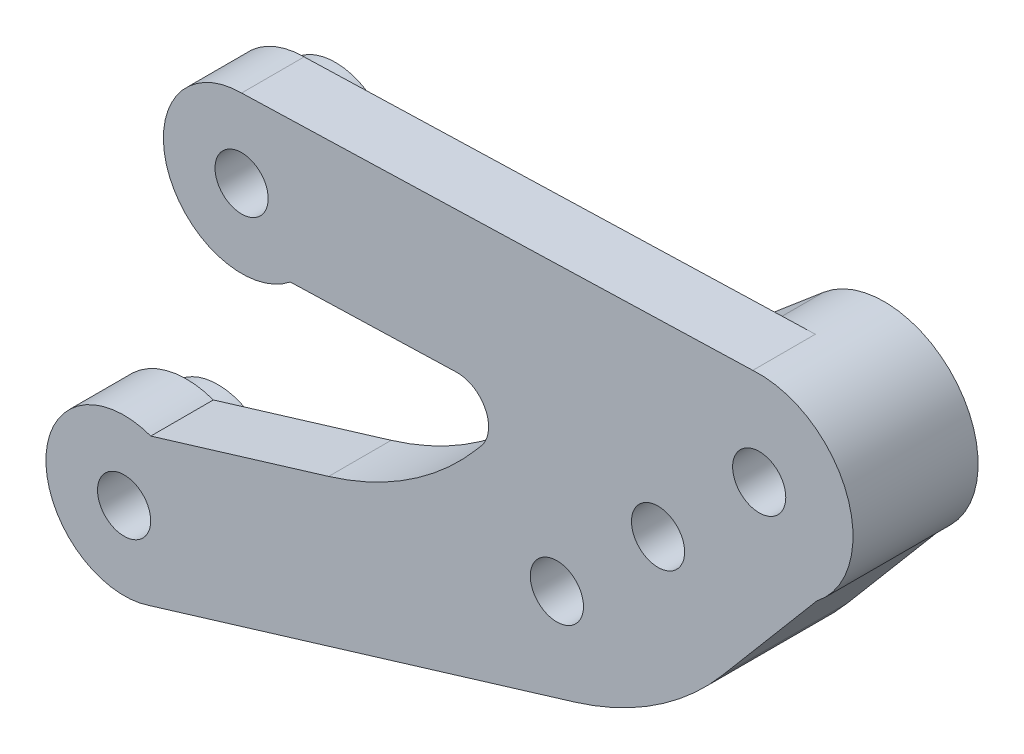
from build123d import *

# Parameters (mm, degrees)
BOSS_EXTRUDE1_DEPTH      = 2
BOSS_EXTRUDE1_DEPTH_BACK = 2
SKETCH2_R                = 1.7
FILLET1_R                = 20
SKETCH7_R                = 1.7
BOSS_EXTRUDE4_DEPTH      = 4
SKETCH8_R                = 3.7
SKETCH8_R_2              = 1.7
BOSS_EXTRUDE5_DEPTH      = 2
FILLET4_R                = 2
F_1_5MM_DOWEL_HOLE1_D    = 3.4


with BuildPart() as part:
    # Sketch2 → Boss-Extrude1 (new, two sides: drawn at the far end of the back side and taken through both)
    with BuildSketch(Plane.XY.offset(-BOSS_EXTRUDE1_DEPTH_BACK)):
        with BuildLine():
            ThreePointArc((1.70658462, 4.699741369), (-4.999520368, 0.069253832), (1.575752274, -4.745208612))
            Line((1.575752274, -4.745208612), (34.456924853, 5.232629629))
            Line((34.456924853, 5.232629629), (44.296635241, 16.864742156))
            ThreePointArc((44.296635241, 16.864742156), (46.218376178, 23.740514028), (40.203783054, 27.586810508))
            Line((40.203783054, 27.586810508), (7.512886707, 26.600773906))
            ThreePointArc((7.512886707, 26.600773906), (2.79322071, 19.950091357), (10.629154827, 17.690675057))
            Line((10.629154827, 17.690675057), (25.733767379, 18.146266751))
            Line((25.733767379, 18.146266751), (18.728666276, 9.86511608))
            Line((18.728666276, 9.86511608), (1.70658462, 4.699741369))
        make_face()
        Circle(SKETCH2_R, mode=Mode.SUBTRACT)
        with Locations((7.512886707, 21.600773906)):
            Circle(SKETCH2_R, mode=Mode.SUBTRACT)
        with Locations((40.612886707, 21.600773906)):
            Circle(SKETCH2_R, mode=Mode.SUBTRACT)
    extrude(amount=BOSS_EXTRUDE1_DEPTH + BOSS_EXTRUDE1_DEPTH_BACK)

    # Fillet1
    fillet1_edges = [part.edges().sort_by_distance(p)[0] for p in [
        (34.456924853, 5.232629629, 0),
        (18.728666276, 9.86511608, 0),
    ]]
    fillet(fillet1_edges, radius=FILLET1_R)

    # Sketch7 → Boss-Extrude4 (add)
    with BuildSketch(Plane(origin=(0, 0, 2), x_dir=(-1, 0, 0), z_dir=(0, 0, -1))):
        with BuildLine():
            Line((-36.733417778, 26.177860406), (-21.683989193, 13.422192867))
            ThreePointArc((-21.683989193, 13.422192867), (-21.70362245, 5.922427438), (-28.807655282, 3.518350802))
            ThreePointArc((-28.807655282, 3.518350802), (-33.988212002, 5.945467438), (-38.269694349, 9.739933408))
            Line((-38.269694349, 9.739933408), (-44.296635241, 16.864742156))
            ThreePointArc((-44.296635241, 16.864742156), (-45.270474012, 25.383217626), (-36.733417778, 26.177860406))
        make_face()
        with Locations((-40.612886707, 21.600773906)):
            Circle(SKETCH7_R, mode=Mode.SUBTRACT)
    extrude(amount=-BOSS_EXTRUDE4_DEPTH)

    # Sketch8 → Boss-Extrude5 (add)
    # profile 1 of 2: a face of its own
    with BuildSketch(Plane(origin=(0, 0, 2), x_dir=(-1, 0, 0), z_dir=(0, 0, -1))):
        with Locations((-7.512886707, 21.600773906)):
            Circle(SKETCH8_R)
        with Locations((-7.512886707, 21.600773906)):
            Circle(SKETCH8_R_2, mode=Mode.SUBTRACT)
    # profile 2 of 2: a face of its own
    with BuildSketch(Plane(origin=(0, 0, 2), x_dir=(-1, 0, 0), z_dir=(0, 0, -1))):
        Circle(SKETCH8_R)
        Circle(SKETCH8_R_2, mode=Mode.SUBTRACT)
    extrude(amount=-BOSS_EXTRUDE5_DEPTH)

    # Fillet4
    fillet4_edges = [part.edges().sort_by_distance(p)[0] for p in [
        (25.733767379, 18.146266751, 0),
    ]]
    fillet(fillet4_edges, radius=FILLET4_R)

    # Ø1.5mm Dowel Hole1 (through all)
    with Locations(Plane.XY.offset(6)):
        with Locations((34.143791756, 15.343713053), (27.674696804, 9.086652201)):
            Hole(F_1_5MM_DOWEL_HOLE1_D / 2)


with BuildPart() as body_2:
    # Mirror3: mirrored copy
    add(part.part.mirror(Plane.XY.offset(-2)))


solid = body_2.part
